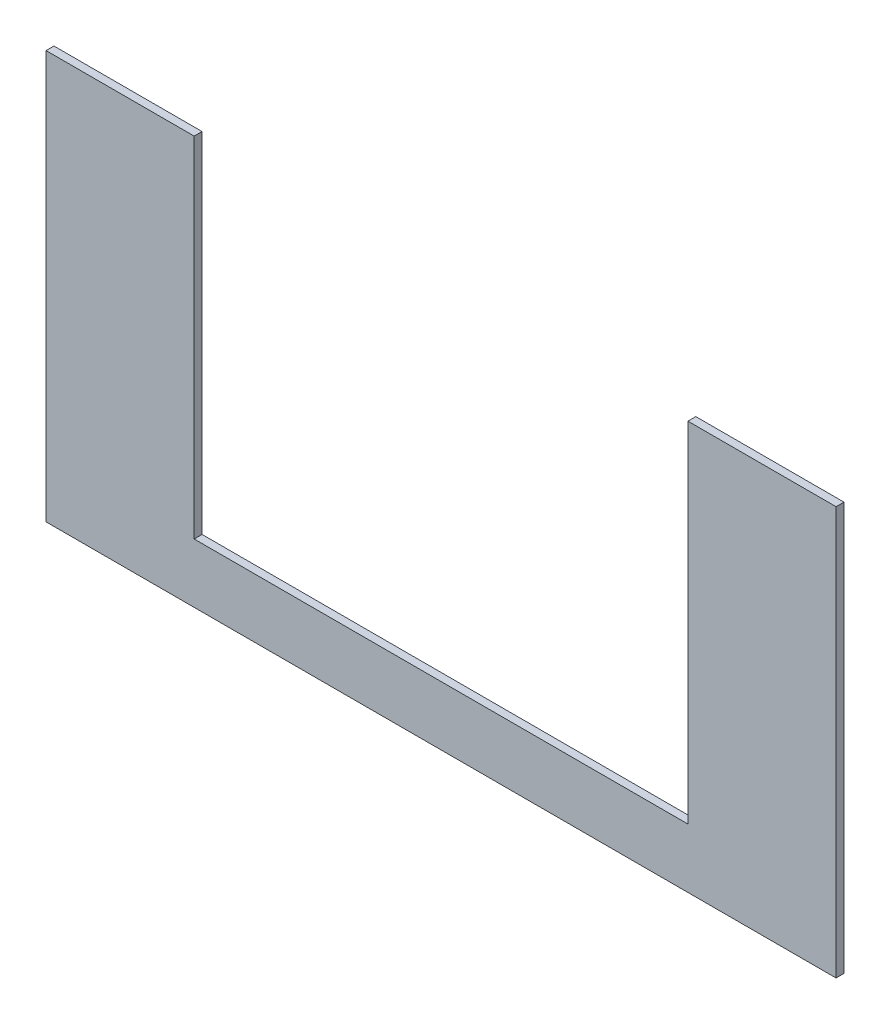
from build123d import *

# Parameters (mm, degrees)
EXTRUDE_1_DEPTH = 6


with BuildPart() as part:
    # Эскиз1 → Бобышка-Вытянуть1 (new body)
    with BuildSketch(Plane.XY):
        Polygon((-592.618659156, -146.009930727), (-480.118659156, -146.009930727), (-480.118659156, -456.009930727), (-1080.118659156, -456.009930727), (-1080.118659156, -146.009930727), (-967.618659156, -146.009930727), (-967.618659156, -411.009930727), (-592.618659156, -411.009930727), align=None)
    extrude(amount=EXTRUDE_1_DEPTH)


solid = part.part
